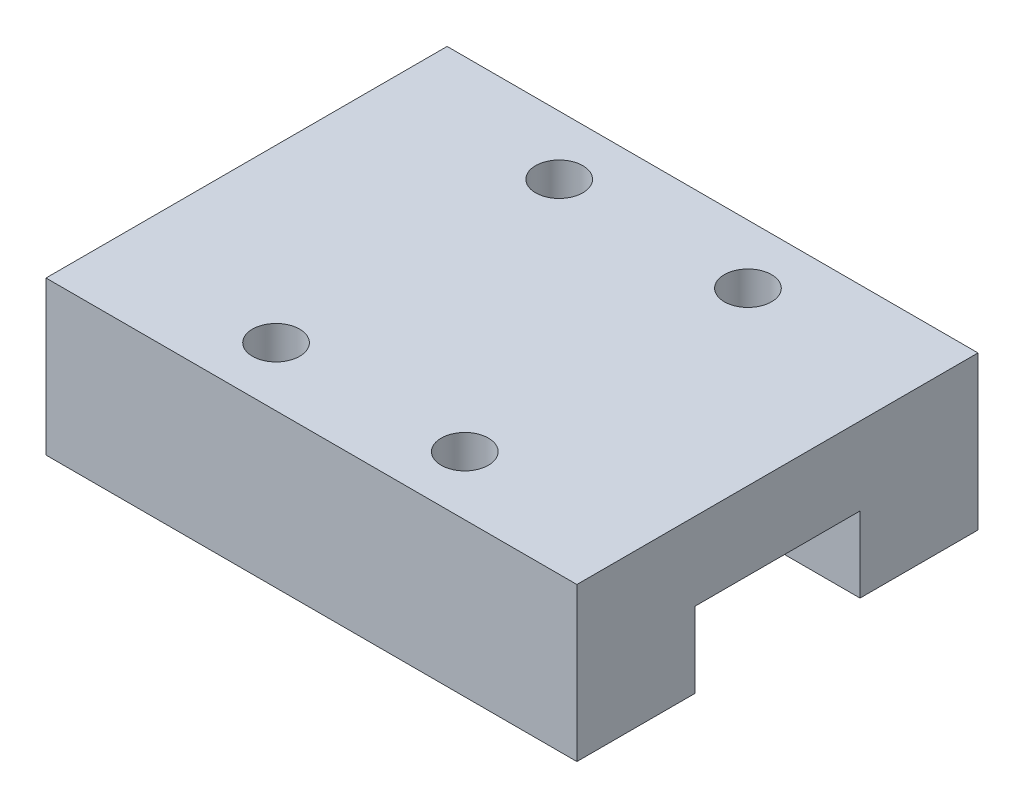
from build123d import *

# Parameters (mm, degrees)
SKETCH_1_W          = 22.5
SKETCH_1_H          = 17
EXTRUDE_1_DEPTH     = 6.5
SKETCH_2_W          = 7
SKETCH_2_H          = 3.2
CUT_EXTRUDE_1_DEPTH = 29.939592257
SKETCH_3_R          = 1
CUT_EXTRUDE_2_DEPTH = 2.4


with BuildPart() as part:
    # 草图1 → 凸台-拉伸1 (new body)
    with BuildSketch(Plane(origin=(0, 0, 0), x_dir=(1, 0, 0), z_dir=(0, 1, 0))):
        with Locations((11.25, 8.5)):
            Rectangle(SKETCH_1_W, SKETCH_1_H)
    extrude(amount=EXTRUDE_1_DEPTH)

    # 草图2 → 切除-拉伸1 (cut, through all)
    with BuildSketch(Plane.ZY):
        with Locations((-8.5, 1.6)):
            Rectangle(SKETCH_2_W, SKETCH_2_H)
    extrude(amount=-CUT_EXTRUDE_1_DEPTH, mode=Mode.SUBTRACT)

    # 草图3 → 切除-拉伸2 (cut)
    with BuildSketch(Plane(origin=(0, 6.5, 0), x_dir=(1, 0, 0), z_dir=(0, 1, 0))):
        with Locations(Location((7.25, 14.5, 0), (0, 0, 270))):
            Circle(SKETCH_3_R)
        with Locations(Location((15.25, 14.5, 0), (0, 0, 270))):
            Circle(SKETCH_3_R)
        with Locations(Location((15.25, 2.5, 0), (0, 0, 90))):
            Circle(SKETCH_3_R)
        with Locations(Location((7.25, 2.5, 0), (0, 0, 90))):
            Circle(SKETCH_3_R)
    extrude(amount=-CUT_EXTRUDE_2_DEPTH, mode=Mode.SUBTRACT)


solid = part.part
